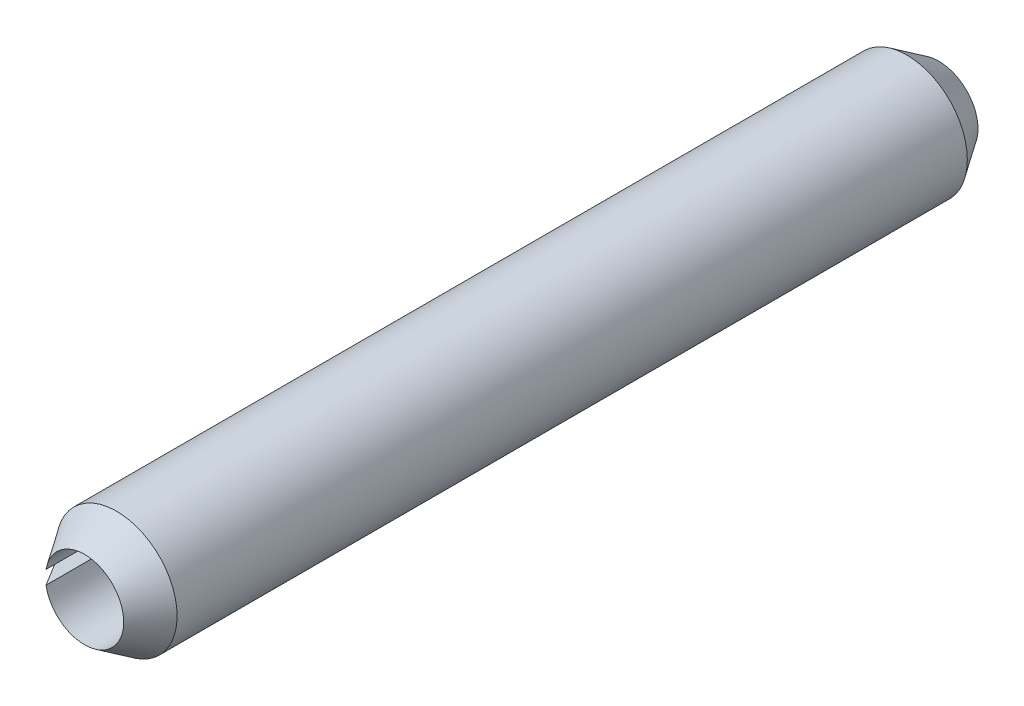
from build123d import *

# Parameters (mm, degrees)
EXTRUDE1_DEPTH = 6


with BuildPart() as part:
    # Sketch1 → Extrude1 (new, symmetric)
    with BuildSketch(Plane.XY):
        with BuildLine():
            Line((-0.83708659, 0.147600951), (-0.541644264, 0.095506498))
            ThreePointArc((-0.541644264, 0.095506498), (0.55, 0), (-0.541644264, -0.095506498))
            Line((-0.541644264, -0.095506498), (-0.83708659, -0.147600951))
            ThreePointArc((-0.83708659, -0.147600951), (0.85, 0), (-0.83708659, 0.147600951))
        make_face()
    extrude(amount=EXTRUDE1_DEPTH, both=True)

    # Sketch2 → Cut-Revolve1 (revolve, cut)
    with BuildSketch(Plane(origin=(0, 0, 0), x_dir=(0, 0, -1), z_dir=(1, 0, 0))):
        Polygon((6, 0.85), (6, 0.55), (5.55, 0.85), align=None)
        Polygon((-5.55, 0.85), (-6, 0.85), (-6, 0.55), align=None)
    revolve(axis=Axis((0, 0, -6), (0, 0, 1)), mode=Mode.SUBTRACT)


solid = part.part
